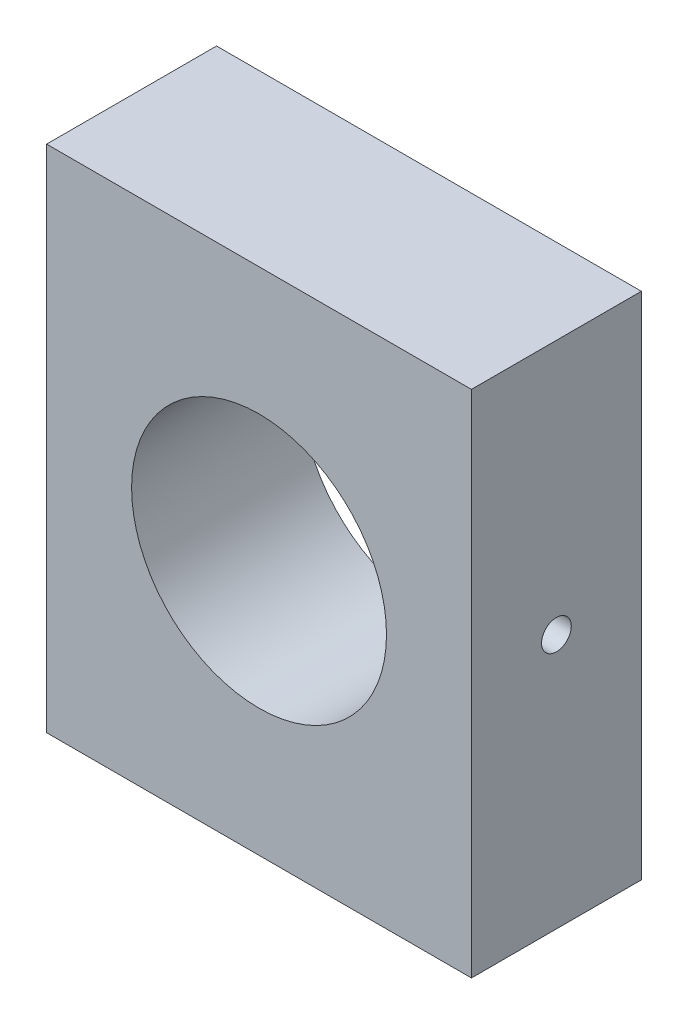
from build123d import *

# Parameters (mm, degrees)
SKETCH1_W           = 100
SKETCH1_H           = 120
SKETCH1_R           = 30
BOSS_EXTRUDE1_DEPTH = 40
SKETCH2_R           = 3.5
CUT_EXTRUDE1_DEPTH  = 15
CUT_EXTRUDE2_START  = -15
SKETCH3_R           = 3.5
CUT_EXTRUDE2_DEPTH  = 15


with BuildPart() as part:
    # Sketch1 → Boss-Extrude1 (new body)
    with BuildSketch(Plane.XY):
        with Locations((15.48649625, -14.939759036)):
            Rectangle(SKETCH1_W, SKETCH1_H)
        with Locations((15.48649625, -14.939759036)):
            Circle(SKETCH1_R, mode=Mode.SUBTRACT)
    extrude(amount=BOSS_EXTRUDE1_DEPTH)

    # Sketch2 → Cut-Extrude1 (cut)
    with BuildSketch(Plane.ZY.offset(34.51350375)):
        with Locations(Location((20, -14.939759036, 0), (0, 0, 270))):
            Circle(SKETCH2_R)
    extrude(amount=-CUT_EXTRUDE1_DEPTH, mode=Mode.SUBTRACT)

    # Sketch3 → Cut-Extrude2 (cut)
    with BuildSketch(Plane(origin=(65.48649625, 0, 0), x_dir=(0, 0, -1), z_dir=(1, 0, 0)).offset(CUT_EXTRUDE2_START)):
        with Locations(Location((-20, -14.939759036, 0), (0, 0, 270))):
            Circle(SKETCH3_R)
    extrude(amount=CUT_EXTRUDE2_DEPTH, mode=Mode.SUBTRACT)


solid = part.part
